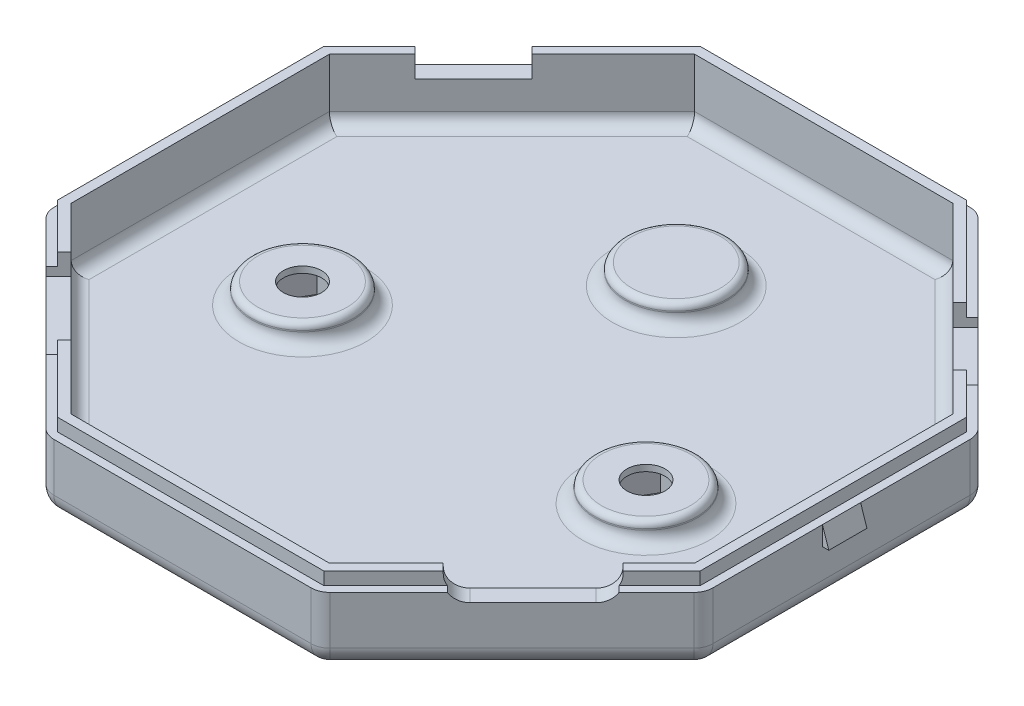
from build123d import *

# Parameters (mm, degrees)
BOSS_EXTRUDE1_DEPTH = 4.9
SKETCH1_4_R         = 4
SKETCH1_4_R_2       = 1.5
BOSS_EXTRUDE2_DEPTH = 1.4
SKETCH1_5_R         = 4
SKETCH1_5_R_2       = 1.5
BOSS_EXTRUDE3_DEPTH = 1.6
FILLET1_R           = 1
FILLET2_R           = 0.5
CUT_EXTRUDE1_DEPTH  = 1.7
FILLET3_R           = 1.5
CUT_EXTRUDE2_DEPTH  = 1
CUT_EXTRUDE4_START  = -10
SKETCH4_R           = 1.5
CUT_EXTRUDE4_DEPTH  = 10
CUT_EXTRUDE5_DEPTH  = 1.1
BOSS_EXTRUDE5_DEPTH = 1.5


with BuildPart() as part:
    # Sketch1 → Boss-Extrude1 (new body)
    with BuildSketch(Plane(origin=(0, 0, 0), x_dir=(1, 0, 0), z_dir=(0, 1, 0))):
        Polygon((10.728131265, -25.9), (25.9, -10.728131265), (25.9, 10.728131265), (10.728131265, 25.9), (-10.728131265, 25.9), (-25.9, 10.728131265), (-25.9, -10.728131265), (-10.728131265, -25.9), align=None)
        Polygon((24.5, -10.148232278), (24.5, 10.148232278), (10.148232278, 24.5), (-10.148232278, 24.5), (-24.5, 10.148232278), (-24.5, -10.148232278), (-10.148232278, -24.5), (10.148232278, -24.5), align=None, mode=Mode.SUBTRACT)
    extrude(amount=BOSS_EXTRUDE1_DEPTH)

    # Sketch1<4> → Boss-Extrude2 (add)
    # profile 1 of 8: a face of its own
    with BuildSketch(Plane(origin=(0, 0, 0), x_dir=(1, 0, 0), z_dir=(0, 1, 0))):
        Polygon((10.728131265, -25.9), (25.9, -10.728131265), (25.9, 10.728131265), (10.728131265, 25.9), (-10.728131265, 25.9), (-25.9, 10.728131265), (-25.9, -10.728131265), (-10.728131265, -25.9), align=None)
        Polygon((24.5, -10.148232278), (24.5, 10.148232278), (10.148232278, 24.5), (-10.148232278, 24.5), (-24.5, 10.148232278), (-24.5, -10.148232278), (-10.148232278, -24.5), (10.148232278, -24.5), align=None, mode=Mode.SUBTRACT)
    # profile 2 of 8: a face of its own
    with BuildSketch(Plane(origin=(0, 0, 0), x_dir=(1, 0, 0), z_dir=(0, 1, 0))):
        Polygon((10.148232278, -24.5), (24.5, -10.148232278), (24.5, 10.148232278), (10.148232278, 24.5), (-10.148232278, 24.5), (-24.5, 10.148232278), (-24.5, -10.148232278), (-10.148232278, -24.5), align=None)
        Polygon((24.1, -9.982546853), (24.1, 9.982546853), (9.982546853, 24.1), (-9.982546853, 24.1), (-24.1, 9.982546853), (-24.1, -9.982546853), (-9.982546853, -24.1), (9.982546853, -24.1), align=None, mode=Mode.SUBTRACT)
    # profile 3 of 8: a face of its own
    with BuildSketch(Plane(origin=(0, 0, 0), x_dir=(1, 0, 0), z_dir=(0, 1, 0))):
        Polygon((9.982546853, -24.1), (24.1, -9.982546853), (24.1, 9.982546853), (9.982546853, 24.1), (-9.982546853, 24.1), (-24.1, 9.982546853), (-24.1, -9.982546853), (-9.982546853, -24.1), align=None)
        with Locations((-13.377453147, -3.09)):
            Circle(SKETCH1_4_R, mode=Mode.SUBTRACT)
        with Locations((13.622546853, -3.09)):
            Circle(SKETCH1_4_R, mode=Mode.SUBTRACT)
    # profile 4 of 8: a face of its own
    with BuildSketch(Plane(origin=(0, 0, 0), x_dir=(1, 0, 0), z_dir=(0, 1, 0))):
        with Locations((13.622546853, -3.09)):
            Circle(SKETCH1_4_R)
        with Locations((13.622546853, -3.09)):
            Circle(SKETCH1_4_R_2, mode=Mode.SUBTRACT)
    # profile 5 of 8: a face of its own
    with BuildSketch(Plane(origin=(0, 0, 0), x_dir=(1, 0, 0), z_dir=(0, 1, 0))):
        with Locations((13.622546853, -3.09)):
            Circle(SKETCH1_4_R_2)
    # profile 6 of 8: a face of its own
    with BuildSketch(Plane(origin=(0, 0, 0), x_dir=(1, 0, 0), z_dir=(0, 1, 0))):
        with Locations((-13.377453147, -3.09)):
            Circle(SKETCH1_4_R)
        with Locations((-13.377453147, -3.09)):
            Circle(SKETCH1_4_R_2, mode=Mode.SUBTRACT)
    # profile 7 of 8: a face of its own
    with BuildSketch(Plane(origin=(0, 0, 0), x_dir=(1, 0, 0), z_dir=(0, 1, 0))):
        with Locations((-13.377453147, -3.09)):
            Circle(SKETCH1_4_R_2)
    # profile 8 of 8: a face of its own
    with BuildSketch(Plane(origin=(0, 0, 0), x_dir=(1, 0, 0), z_dir=(0, 1, 0))):
        with Locations((0, 12.91)):
            Circle(SKETCH1_4_R)
    extrude(amount=-BOSS_EXTRUDE2_DEPTH)

    # Sketch1<5> → Boss-Extrude3 (add)
    # profile 1 of 3: a face of its own
    with BuildSketch(Plane(origin=(0, 0, 0), x_dir=(1, 0, 0), z_dir=(0, 1, 0))):
        with Locations(Location((-13.377453147, -3.09, 0), (0, 0, 270))):
            Circle(SKETCH1_5_R)
        with Locations(Location((-13.377453147, -3.09, 0), (0, 0, 270))):
            Circle(SKETCH1_5_R_2, mode=Mode.SUBTRACT)
    # profile 2 of 3: a face of its own
    with BuildSketch(Plane(origin=(0, 0, 0), x_dir=(1, 0, 0), z_dir=(0, 1, 0))):
        with Locations(Location((13.622546853, -3.09, 0), (0, 0, 270))):
            Circle(SKETCH1_5_R)
        with Locations(Location((13.622546853, -3.09, 0), (0, 0, 270))):
            Circle(SKETCH1_5_R_2, mode=Mode.SUBTRACT)
    # profile 3 of 3: a face of its own
    with BuildSketch(Plane(origin=(0, 0, 0), x_dir=(1, 0, 0), z_dir=(0, 1, 0))):
        with Locations(Location((0, 12.91, 0), (0, 0, 270))):
            Circle(SKETCH1_5_R)
    extrude(amount=BOSS_EXTRUDE3_DEPTH)

    # Fillet1
    fillet1_edges = [part.edges().sort_by_distance(p)[0] for p in [
        (17.324116139, 0, -17.324116139),
        (0, 0, -24.5),
        (-17.324116139, 0, -17.324116139),
        (-24.5, 0, 0),
        (-17.324116139, 0, 17.324116139),
        (0, 0, 24.5),
        (17.324116139, 0, 17.324116139),
        (24.5, 0, 0),
        (-13.377453147, 0, -0.91),
        (13.622546853, 0, -0.91),
        (0, 0, -16.91),
    ]]
    fillet(fillet1_edges, radius=FILLET1_R)

    # Fillet2
    fillet2_edges = [part.edges().sort_by_distance(p)[0] for p in [
        (-13.377453147, 1.6, -0.91),
        (13.622546853, 1.6, -0.91),
        (0, 1.6, -16.91),
    ]]
    fillet(fillet2_edges, radius=FILLET2_R)

    # Sketch2 → Cut-Extrude1 (cut)
    with BuildSketch(Plane(origin=(0, 4.9, 0), x_dir=(1, 0, 0), z_dir=(0, 1, 0))):
        Polygon((-22.116978721, 14.511152545), (-21.127029227, 13.521203051), (-16.530835149, 18.117397129), (-17.520784643, 19.107346623), align=None)
        Polygon((16.919743879, 17.728488399), (17.909693373, 18.718437893), (22.50588745, 14.122243815), (21.515937957, 13.132294321), align=None)
        Polygon((21.692714652, -12.955517626), (22.682664146, -13.94546712), (15.611596334, -21.016534932), (14.62164684, -20.026585438), align=None)
        Polygon((-21.197739905, -13.450492373), (-22.187689399, -14.440441867), (-16.177281759, -20.450849507), (-15.187332265, -19.460900013), align=None)
    extrude(amount=-CUT_EXTRUDE1_DEPTH, mode=Mode.SUBTRACT)

    # Fillet3
    fillet3_edges = [part.edges().sort_by_distance(p)[0] for p in [
        (15.116621587, 3.2, 20.521560185),
        (22.187689399, 3.2, 13.450492373),
        (10.728131265, 1.75, 25.9),
        (-10.728131265, 1.75, 25.9),
        (-25.9, 1.75, 10.728131265),
        (-25.9, 1.75, -10.728131265),
        (-10.728131265, 1.75, -25.9),
        (10.728131265, 1.75, -25.9),
        (25.9, 1.75, -10.728131265),
        (25.9, 1.75, 10.728131265),
        (18.314065633, -1.4, 18.314065633),
        (0, -1.4, 25.9),
        (-18.314065633, -1.4, 18.314065633),
        (-25.9, -1.4, 0),
        (-18.314065633, -1.4, -18.314065633),
        (0, -1.4, -25.9),
        (18.314065633, -1.4, -18.314065633),
        (25.9, -1.4, 0),
    ]]
    fillet(fillet3_edges, radius=FILLET3_R)

    # Sketch3 → Cut-Extrude2 (cut)
    with BuildSketch(Plane(origin=(0, 4.9, 0), x_dir=(1, 0, 0), z_dir=(0, 1, 0))):
        Polygon((16.212637098, -19.496255352), (15.151976926, -20.556915524), (15.611596334, -21.016534932), (22.682664146, -13.94546712), (22.223044738, -13.485847712), (21.162384566, -14.546507884), align=None)
        with BuildLine():
            Line((22.223044738, -13.485847712), (22.682664146, -13.94546712))
            Line((22.682664146, -13.94546712), (25.460660172, -11.167471094))
            ThreePointArc((25.460660172, -11.167471094), (25.785819299, -10.68083607), (25.9, -10.106810922))
            Line((25.9, -10.106810922), (25.9, 10.106810922))
            ThreePointArc((25.9, 10.106810922), (25.785819299, 10.68083607), (25.460660172, 11.167471094))
            Line((25.460660172, 11.167471094), (22.50588745, 14.122243815))
            Line((22.50588745, 14.122243815), (22.046268043, 13.662624407))
            Line((22.046268043, 13.662624407), (25.25, 10.45889245))
            Line((25.25, 10.45889245), (25.25, -10.45889245))
            Line((25.25, -10.45889245), (22.223044738, -13.485847712))
        make_face()
        with BuildLine():
            Line((15.611596334, -21.016534932), (15.151976926, -20.556915524))
            Line((15.151976926, -20.556915524), (10.45889245, -25.25))
            Line((10.45889245, -25.25), (-10.45889245, -25.25))
            Line((-10.45889245, -25.25), (-15.717662351, -19.991230099))
            Line((-15.717662351, -19.991230099), (-16.177281759, -20.450849507))
            Line((-16.177281759, -20.450849507), (-11.167471094, -25.460660172))
            ThreePointArc((-11.167471094, -25.460660172), (-10.68083607, -25.785819299), (-10.106810922, -25.9))
            Line((-10.106810922, -25.9), (10.106810922, -25.9))
            ThreePointArc((10.106810922, -25.9), (10.68083607, -25.785819299), (11.167471094, -25.460660172))
            Line((11.167471094, -25.460660172), (15.611596334, -21.016534932))
        make_face()
        with BuildLine():
            Line((-22.187689399, -14.440441867), (-21.728069991, -13.980822459))
            Line((-21.728069991, -13.980822459), (-25.25, -10.45889245))
            Line((-25.25, -10.45889245), (-25.25, 10.45889245))
            Line((-25.25, 10.45889245), (-21.657359313, 14.051533137))
            Line((-21.657359313, 14.051533137), (-22.116978721, 14.511152545))
            Line((-22.116978721, 14.511152545), (-25.460660172, 11.167471094))
            ThreePointArc((-25.460660172, 11.167471094), (-25.785819299, 10.68083607), (-25.9, 10.106810922))
            Line((-25.9, 10.106810922), (-25.9, -10.106810922))
            ThreePointArc((-25.9, -10.106810922), (-25.785819299, -10.68083607), (-25.460660172, -11.167471094))
            Line((-25.460660172, -11.167471094), (-22.187689399, -14.440441867))
        make_face()
        with BuildLine():
            Line((10.45889245, 25.25), (17.450073965, 18.258818485))
            Line((17.450073965, 18.258818485), (17.909693373, 18.718437893))
            Line((17.909693373, 18.718437893), (11.167471094, 25.460660172))
            ThreePointArc((11.167471094, 25.460660172), (10.68083607, 25.785819299), (10.106810922, 25.9))
            Line((10.106810922, 25.9), (-10.106810922, 25.9))
            ThreePointArc((-10.106810922, 25.9), (-10.68083607, 25.785819299), (-11.167471094, 25.460660172))
            Line((-11.167471094, 25.460660172), (-17.520784643, 19.107346623))
            Line((-17.520784643, 19.107346623), (-17.061165235, 18.647727215))
            Line((-17.061165235, 18.647727215), (-10.45889245, 25.25))
            Line((-10.45889245, 25.25), (10.45889245, 25.25))
        make_face()
    extrude(amount=-CUT_EXTRUDE2_DEPTH, mode=Mode.SUBTRACT)

    # Sketch4 → Cut-Extrude4 (cut)
    # profile 1 of 4: a face of its own
    with BuildSketch(Plane(origin=(0, 0, 0), x_dir=(1, 0, 0), z_dir=(0, 1, 0)).offset(CUT_EXTRUDE4_START)):
        Polygon((-14.936298874, -5.79), (-11.81860742, -5.79), (-10.259761693, -3.09), (-11.81860742, -0.39), (-14.936298874, -0.39), (-16.4951446, -3.09), align=None)
        with Locations(Location((-13.377453147, -3.09, 0), (0, 0, 270))):
            Circle(SKETCH4_R, mode=Mode.SUBTRACT)
    # profile 2 of 4: a face of its own
    with BuildSketch(Plane(origin=(0, 0, 0), x_dir=(1, 0, 0), z_dir=(0, 1, 0)).offset(CUT_EXTRUDE4_START)):
        with Locations(Location((-13.377453147, -3.09, 0), (0, 0, 270))):
            Circle(SKETCH4_R)
    # profile 3 of 4: a face of its own
    with BuildSketch(Plane(origin=(0, 0, 0), x_dir=(1, 0, 0), z_dir=(0, 1, 0)).offset(CUT_EXTRUDE4_START)):
        Polygon((15.18139258, -0.39), (12.063701126, -0.39), (10.5048554, -3.09), (12.063701126, -5.79), (15.18139258, -5.79), (16.740238307, -3.09), align=None)
        with Locations(Location((13.622546853, -3.09, 0), (0, 0, 270))):
            Circle(SKETCH4_R, mode=Mode.SUBTRACT)
    # profile 4 of 4: a face of its own
    with BuildSketch(Plane(origin=(0, 0, 0), x_dir=(1, 0, 0), z_dir=(0, 1, 0)).offset(CUT_EXTRUDE4_START)):
        with Locations(Location((13.622546853, -3.09, 0), (0, 0, 270))):
            Circle(SKETCH4_R)
    extrude(amount=CUT_EXTRUDE4_DEPTH, mode=Mode.SUBTRACT)

    # Sketch5 → Cut-Extrude5 (cut)
    with BuildSketch(Plane.XZ):
        Polygon((-11.81860742, 5.79), (-14.936298874, 5.79), (-16.4951446, 3.09), (-14.936298874, 0.39), (-11.81860742, 0.39), (-10.259761693, 3.09), align=None)
        Polygon((12.063701126, 0.39), (15.18139258, 0.39), (16.740238307, 3.09), (15.18139258, 5.79), (12.063701126, 5.79), (10.5048554, 3.09), align=None)
    extrude(amount=-CUT_EXTRUDE5_DEPTH, mode=Mode.SUBTRACT)

    # Sketch7 → Boss-Extrude5 (add, symmetric)
    with BuildSketch(Plane.XY):
        Polygon((-25.9, 3.9), (-26.4, 2.4), (-25.9, 2.4), align=None)
        Polygon((25.9, 3.9), (26.4, 2.4), (25.9, 2.4), align=None)
    extrude(amount=BOSS_EXTRUDE5_DEPTH, both=True)


solid = part.part
